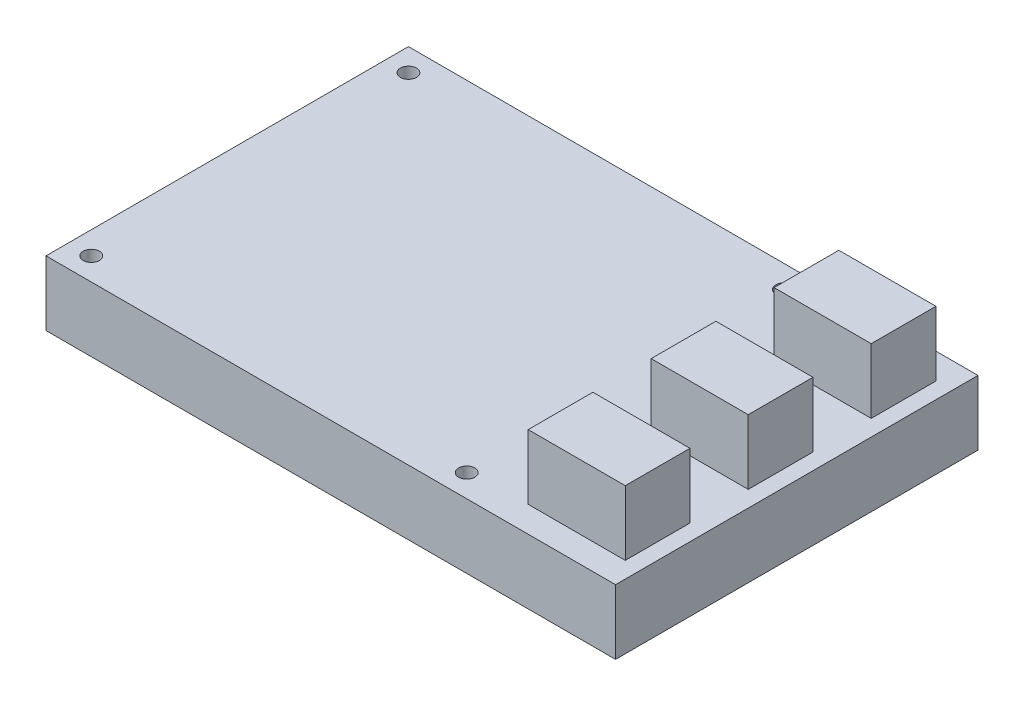
from build123d import *

# Parameters (mm, degrees)
SKETCH1_W           = 88
SKETCH1_H           = 56
BOSS_EXTRUDE2_DEPTH = 10
SKETCH2_R           = 1.25
CUT_EXTRUDE1_DEPTH  = 10
SKETCH3_W           = 15
SKETCH3_H           = 10
BOSS_EXTRUDE3_DEPTH = 10


with BuildPart() as part:
    # Sketch1 → Boss-Extrude2 (new body)
    with BuildSketch(Plane(origin=(0, 0, 0), x_dir=(1, 0, 0), z_dir=(0, 1, 0))):
        Rectangle(SKETCH1_W, SKETCH1_H)
    extrude(amount=BOSS_EXTRUDE2_DEPTH)

    # Sketch2 → Cut-Extrude1 (cut)
    with BuildSketch(Plane(origin=(0, 10, 0), x_dir=(1, 0, 0), z_dir=(0, 1, 0))):
        with Locations(Location((-40.5, 24.5, 0), (0, 0, 270))):
            Circle(SKETCH2_R)
        with Locations(Location((17.5, 24.5, 0), (0, 0, 270))):
            Circle(SKETCH2_R)
        with Locations(Location((-40.5, -24.5, 0), (0, 0, 270))):
            Circle(SKETCH2_R)
        with Locations(Location((17.5, -24.5, 0), (0, 0, 270))):
            Circle(SKETCH2_R)
    extrude(amount=-CUT_EXTRUDE1_DEPTH, mode=Mode.SUBTRACT)

    # Sketch3 → Boss-Extrude3 (add)
    with BuildSketch(Plane(origin=(0, 10, 0), x_dir=(1, 0, 0), z_dir=(0, 1, 0))):
        with Locations((34, 19)):
            Rectangle(SKETCH3_W, SKETCH3_H)
        with Locations((34, 0)):
            Rectangle(SKETCH3_W, SKETCH3_H)
        with Locations((34, -19)):
            Rectangle(SKETCH3_W, SKETCH3_H)
    extrude(amount=BOSS_EXTRUDE3_DEPTH)


solid = part.part
